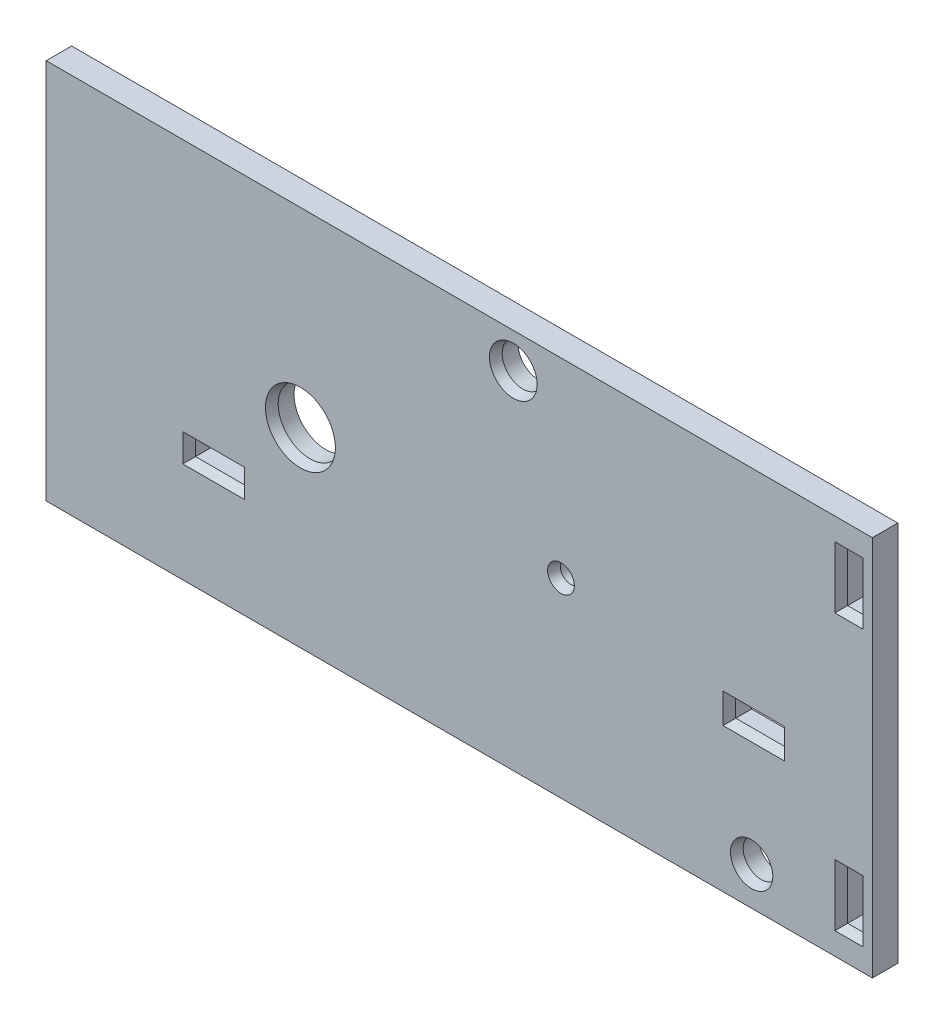
from build123d import *

# Parameters (mm, degrees)
SKETCH1_W           = 130
SKETCH1_H           = 60
SKETCH1_R           = 5
SKETCH1_R_2         = 3.25
SKETCH1_R_3         = 2.83
SKETCH1_R_4         = 1.6
SKETCH1_W_2         = 8.7
SKETCH1_H_2         = 3.4
SKETCH1_W_3         = 3.4
SKETCH1_H_3         = 8.7
SKETCH1_H_4         = 3.7
BOSS_EXTRUDE1_DEPTH = 2
CHAMFER1_SIZE       = 0.5
CHAMFER1_SIZE2      = 1.5


with BuildPart() as part:
    # Sketch1 → Boss-Extrude1 (new, symmetric)
    with BuildSketch(Plane.XY):
        with Locations((-21, 0)):
            Rectangle(SKETCH1_W, SKETCH1_H)
        with Locations((-46, 0)):
            Circle(SKETCH1_R, mode=Mode.SUBTRACT)
        with Locations((-12.5, 24.5)):
            Circle(SKETCH1_R_2, mode=Mode.SUBTRACT)
        with Locations((25, -24)):
            Circle(SKETCH1_R_3, mode=Mode.SUBTRACT)
        with Locations((-5, 0)):
            Circle(SKETCH1_R_4, mode=Mode.SUBTRACT)
        with Locations((-59.65, -12)):
            Rectangle(SKETCH1_W_2, SKETCH1_H_2, mode=Mode.SUBTRACT)
        with Locations((40.3, 21.65)):
            Rectangle(SKETCH1_W_3, SKETCH1_H_3, mode=Mode.SUBTRACT)
        with Locations((40.3, -21.65)):
            Rectangle(SKETCH1_W_3, SKETCH1_H_3, mode=Mode.SUBTRACT)
        with Locations((25.35, -5)):
            Rectangle(SKETCH1_W_2, SKETCH1_H_4, mode=Mode.SUBTRACT)
    extrude(amount=BOSS_EXTRUDE1_DEPTH, both=True)

    # Chamfer1
    chamfer1_edges = [part.edges().sort_by_distance(p)[0] for p in [
        (21, -5, 2),
        (25.35, -6.85, 2),
        (29.7, -5, 2),
        (25.35, -3.15, 2),
        (-64, -12, 2),
        (-59.65, -13.7, 2),
        (-55.3, -12, 2),
        (-59.65, -10.3, 2),
        (-15.75, 24.5, 2),
        (-51, 0, 2),
        (22.17, -24, 2),
        (-6.6, 0, 2),
        (38.6, 21.65, 2),
        (40.3, 17.3, 2),
        (42, 21.65, 2),
        (40.3, 26, 2),
        (38.6, -21.65, 2),
        (40.3, -26, 2),
        (42, -21.65, 2),
        (40.3, -17.3, 2),
    ]]
    chamfer1_side = [part.faces().sort_by_distance(p)[0] for p in [
        (-21.475154196, 0.040718834, 2),
    ]]
    chamfer(chamfer1_edges, length=CHAMFER1_SIZE, length2=CHAMFER1_SIZE2, reference=chamfer1_side[0])


solid = part.part
